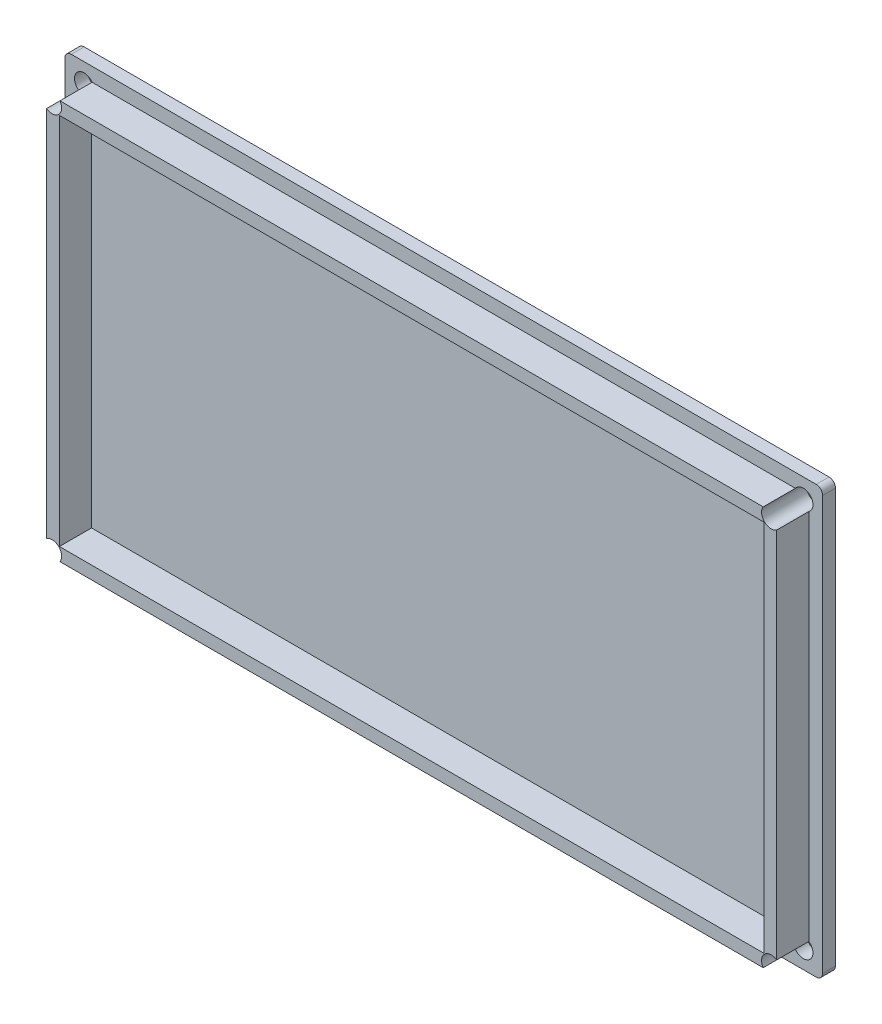
from build123d import *

# Parameters (mm, degrees)
SKETCH1_W                                  = 117.9
SKETCH1_H                                  = 66.4
BOSS_EXTRUDE1_DEPTH                        = 2
SKETCH2_W                                  = 113.6
SKETCH2_H                                  = 62.1
SKETCH2_W_2                                = 109.6
SKETCH2_H_2                                = 58.1
BOSS_EXTRUDE2_DEPTH                        = 5
SKETCH3_R                                  = 1.5
CUT_EXTRUDE2_DEPTH                         = 71.854336818
MIRROR3_AT_THE_SECOND_PLANE_COPY_1_SKETC_R = 1.5
MIRROR3_AT_THE_SECOND_PLANE_COPY_1_DEPTH   = 71.854336818
FILLET1_R                                  = 1


with BuildPart() as part:
    # Sketch1 → Boss-Extrude1 (new body)
    with BuildSketch(Plane.XY):
        with Locations((3.252066252, 0)):
            Rectangle(SKETCH1_W, SKETCH1_H)
    extrude(amount=BOSS_EXTRUDE1_DEPTH)

    # Sketch2 → Boss-Extrude2 (add)
    with BuildSketch(Plane.XY.offset(2)):
        with Locations((3.252066252, 0)):
            Rectangle(SKETCH2_W, SKETCH2_H)
        with Locations((3.252066252, 0)):
            Rectangle(SKETCH2_W_2, SKETCH2_H_2, mode=Mode.SUBTRACT)
    extrude(amount=BOSS_EXTRUDE2_DEPTH)

    # Sketch3 → Cut-Extrude2 (cut, symmetric)
    with BuildSketch(Plane(origin=(0, 0, 0), x_dir=(-1, 0, 0), z_dir=(0, 0, -1))):
        with Locations(Location((-59.202066252, 30.2, 0), (0, 0, 34.518107841))):
            Circle(SKETCH3_R)
    cut_extrude2 = extrude(amount=CUT_EXTRUDE2_DEPTH, both=True, mode=Mode.SUBTRACT)

    # Mirror2: Cut-Extrude2 across plane
    add(cut_extrude2.mirror(Plane.ZX), mode=Mode.SUBTRACT)

    # Mirror3: Cut-Extrude2 across plane
    add(cut_extrude2.mirror(Plane.ZX), mode=Mode.SUBTRACT)

    # Mirror3 at the second plane: Cut-Extrude2 across plane
    add(cut_extrude2.mirror(Plane(origin=(3.252066252, 0, 0), x_dir=(0, 0, 1), z_dir=(1, 0, 0))), mode=Mode.SUBTRACT)

    # Mirror3 at the second plane copy 1 sketc → Mirror3 at the second plane copy 1 (cut, symmetric)
    with BuildSketch(Plane(origin=(6.504132503, 0, 0), x_dir=(1, 0, 0), z_dir=(0, 0, -1))):
        with Locations(Location((-59.202066252, 30.2, 0), (0, 0, 34.518107841))):
            Circle(MIRROR3_AT_THE_SECOND_PLANE_COPY_1_SKETC_R)
    extrude(amount=MIRROR3_AT_THE_SECOND_PLANE_COPY_1_DEPTH, both=True, mode=Mode.SUBTRACT)

    # Fillet1
    fillet1_edges = [part.edges().sort_by_distance(p)[0] for p in [
        (62.202066252, -33.2, 1),
        (-55.697933748, -33.2, 1),
        (-55.697933748, 33.2, 1),
        (62.202066252, 33.2, 1),
    ]]
    fillet(fillet1_edges, radius=FILLET1_R)


solid = part.part
